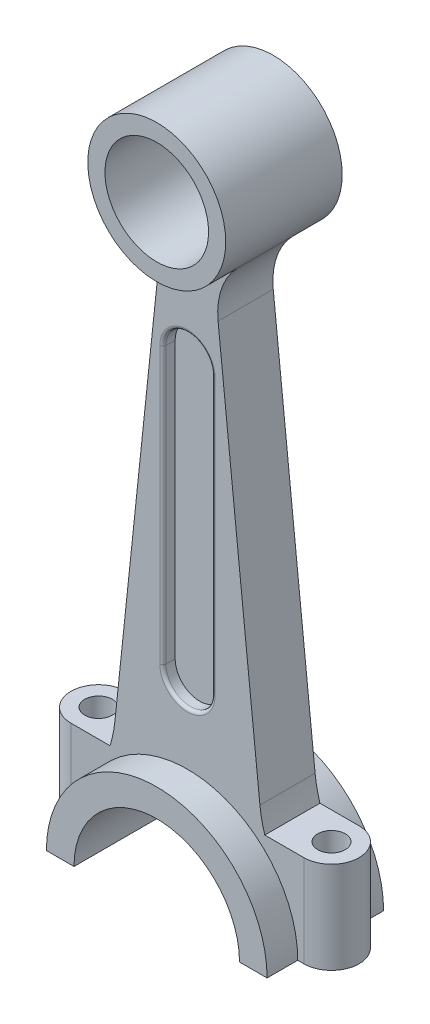
from build123d import *

# Parameters (mm, degrees)
SKETCH1_R              = 22.5
SKETCH1_R_2            = 16.9
BOSS_EXTRUDE1_DEPTH    = 19
BOSS_EXTRUDE1_2_DEPTH  = 19
BOSS_EXTRUDE2_DEPTH    = 9
BOSS_EXTRUDE3_DEPTH    = 9
FILLET1_RADIUS         = 9
FILLET1_LENGTH         = 30
FILLET2_RADIUS         = 9
FILLET2_LENGTH         = 30
BOSS_EXTRUDE4_DEPTH    = 5
FILLET3_R              = 1
M10X1_5_TAPPED_HOLE1_D = 9


with BuildPart() as part:
    # Sketch1 → Boss-Extrude1 (new, symmetric)
    with BuildSketch(Plane.XY):
        with Locations((0, 201.2)):
            Circle(SKETCH1_R)
        with Locations((0, 201.2)):
            Circle(SKETCH1_R_2, mode=Mode.SUBTRACT)
    extrude(amount=BOSS_EXTRUDE1_DEPTH, both=True)



with BuildPart() as body_2:
    # Sketch1 → Boss-Extrude1 2 (new, symmetric)
    with BuildSketch(Plane.XY):
        with BuildLine():
            ThreePointArc((30.048695698, 19.826141501), (25.487028558, 25.424621439), (19.899748742, 30))
            ThreePointArc((19.899748742, 30), (0, 36), (-19.899748742, 30))
            ThreePointArc((-19.899748742, 30), (-25.487028558, 25.424621439), (-30.048695698, 19.826141501))
            ThreePointArc((-30.048695698, 19.826141501), (-34.480088784, 10.350047219), (-36, 0))
            Line((-36, 0), (-27, 0))
            ThreePointArc((-27, 0), (0, 27), (27, 0))
            Line((27, 0), (36, 0))
            ThreePointArc((36, 0), (34.480088784, 10.350047219), (30.048695698, 19.826141501))
        make_face()
    extrude(amount=BOSS_EXTRUDE1_2_DEPTH, both=True)


with BuildPart() as part_1:
    add(part.part)

    add(body_2.part)  # Boss-Extrude2 merges body 2
    # Sketch1<3> → Boss-Extrude2 (add, symmetric)
    with BuildSketch(Plane.XY):
        with BuildLine():
            Line((23.655259549, 37.674049083), (10, 167.595165145))
            ThreePointArc((10, 167.595165145), (11.1018188, 177.270143397), (16.188371323, 185.573527784))
            ThreePointArc((16.188371323, 185.573527784), (0, 178.7), (-16.188371323, 185.573527784))
            ThreePointArc((-16.188371323, 185.573527784), (-11.1018188, 177.270143397), (-10, 167.595165145))
            Line((-10, 167.595165145), (-23.655259549, 37.674049083))
            ThreePointArc((-23.655259549, 37.674049083), (-24.2559556, 33.798295304), (-25.233327526, 30))
            Line((-25.233327526, 30), (-19.899748742, 30))
            ThreePointArc((-19.899748742, 30), (0, 36), (19.899748742, 30))
            Line((19.899748742, 30), (25.233327526, 30))
            ThreePointArc((25.233327526, 30), (24.2559556, 33.798295304), (23.655259549, 37.674049083))
        make_face()
        with BuildLine():
            ThreePointArc((-8, 151.2), (0, 159.2), (8, 151.2))
            Line((8, 151.2), (8, 61.2))
            ThreePointArc((8, 61.2), (0, 53.2), (-8, 61.2))
            Line((-8, 61.2), (-8, 151.2))
        make_face(mode=Mode.SUBTRACT)
    extrude(amount=BOSS_EXTRUDE2_DEPTH, both=True)

    # Sketch1<4> → Boss-Extrude3 (add, symmetric)
    with BuildSketch(Plane.XY):
        with BuildLine():
            Line((47, 30), (25.233327526, 30))
            ThreePointArc((25.233327526, 30), (27.281360664, 24.742845095), (30.048695698, 19.826141501))
            ThreePointArc((30.048695698, 19.826141501), (34.480088784, 10.350047219), (36, 0))
            Line((36, 0), (47, 0))
            Line((47, 0), (47, 30))
        make_face()
        with BuildLine():
            ThreePointArc((30.048695698, 19.826141501), (27.281360664, 24.742845095), (25.233327526, 30))
            Line((25.233327526, 30), (19.899748742, 30))
            ThreePointArc((19.899748742, 30), (25.487028558, 25.424621439), (30.048695698, 19.826141501))
        make_face()
        with BuildLine():
            ThreePointArc((-30.048695698, 19.826141501), (-25.487028558, 25.424621439), (-19.899748742, 30))
            Line((-19.899748742, 30), (-25.233327526, 30))
            ThreePointArc((-25.233327526, 30), (-27.281360664, 24.742845095), (-30.048695698, 19.826141501))
        make_face()
        with BuildLine():
            ThreePointArc((-30.048695698, 19.826141501), (-27.281360664, 24.742845095), (-25.233327526, 30))
            Line((-25.233327526, 30), (-47, 30))
            Line((-47, 30), (-47, 0))
            Line((-47, 0), (-36, 0))
            ThreePointArc((-36, 0), (-34.480088784, 10.350047219), (-30.048695698, 19.826141501))
        make_face()
    extrude(amount=BOSS_EXTRUDE3_DEPTH, both=True)

    # Fillet1: full round fillet: the end face becomes a half cylinder, R = half its width
    fillet1_face = Plane((-47, 15, 0), x_dir=(0, 1, 0), z_dir=(-1, 0, 0))  # on the end face: x along it, z out of the body
    fillet1_slab = fillet1_face.offset(-FILLET1_RADIUS / 2) * Box(FILLET1_LENGTH, 2 * FILLET1_RADIUS, FILLET1_RADIUS, mode=Mode.PRIVATE)  # the body's end, R deep
    fillet1_round = Plane((-38, 15, 0), x_dir=(-1, 0, 0), z_dir=(0, 1, 0)) * Cylinder(FILLET1_RADIUS, FILLET1_LENGTH, mode=Mode.PRIVATE)  # its axis R under the face
    add(fillet1_slab - fillet1_round, mode=Mode.SUBTRACT)

    # Fillet2: full round fillet: the end face becomes a half cylinder, R = half its width
    fillet2_face = Plane((47, 15, 0), x_dir=(0, 1, 0), z_dir=(1, 0, 0))  # on the end face: x along it, z out of the body
    fillet2_slab = fillet2_face.offset(-FILLET2_RADIUS / 2) * Box(FILLET2_LENGTH, 2 * FILLET2_RADIUS, FILLET2_RADIUS, mode=Mode.PRIVATE)  # the body's end, R deep
    fillet2_round = Plane((38, 15, 0), x_dir=(1, 0, 0), z_dir=(0, 1, 0)) * Cylinder(FILLET2_RADIUS, FILLET2_LENGTH, mode=Mode.PRIVATE)  # its axis R under the face
    add(fillet2_slab - fillet2_round, mode=Mode.SUBTRACT)

    # Sketch1<5> → Boss-Extrude4 (add, symmetric)
    with BuildSketch(Plane.XY):
        with BuildLine():
            Line((-8, 151.2), (-8, 61.2))
            ThreePointArc((-8, 61.2), (0, 53.2), (8, 61.2))
            Line((8, 61.2), (8, 151.2))
            ThreePointArc((8, 151.2), (0, 159.2), (-8, 151.2))
        make_face()
    extrude(amount=BOSS_EXTRUDE4_DEPTH, both=True)

    # Fillet3
    fillet3_edges = [part_1.edges().sort_by_distance(p)[0] for p in [
        (0, 53.2, 9),
        (-8, 106.2, 9),
        (0, 159.2, 9),
        (8, 106.2, -9),
        (8, 106.2, 9),
        (0, 53.2, -9),
        (0, 159.2, -9),
        (-8, 106.2, -9),
    ]]
    fillet(fillet3_edges, radius=FILLET3_R)

    # M10x1.5 Tapped Hole1 (through all)
    with Locations(Plane(origin=(0, 0, 0), x_dir=(-1, 0, 0), z_dir=(0, -1, 0))):
        with Locations((-38, 0), (38, 0)):
            Hole(M10X1_5_TAPPED_HOLE1_D / 2)


solid = part_1.part
